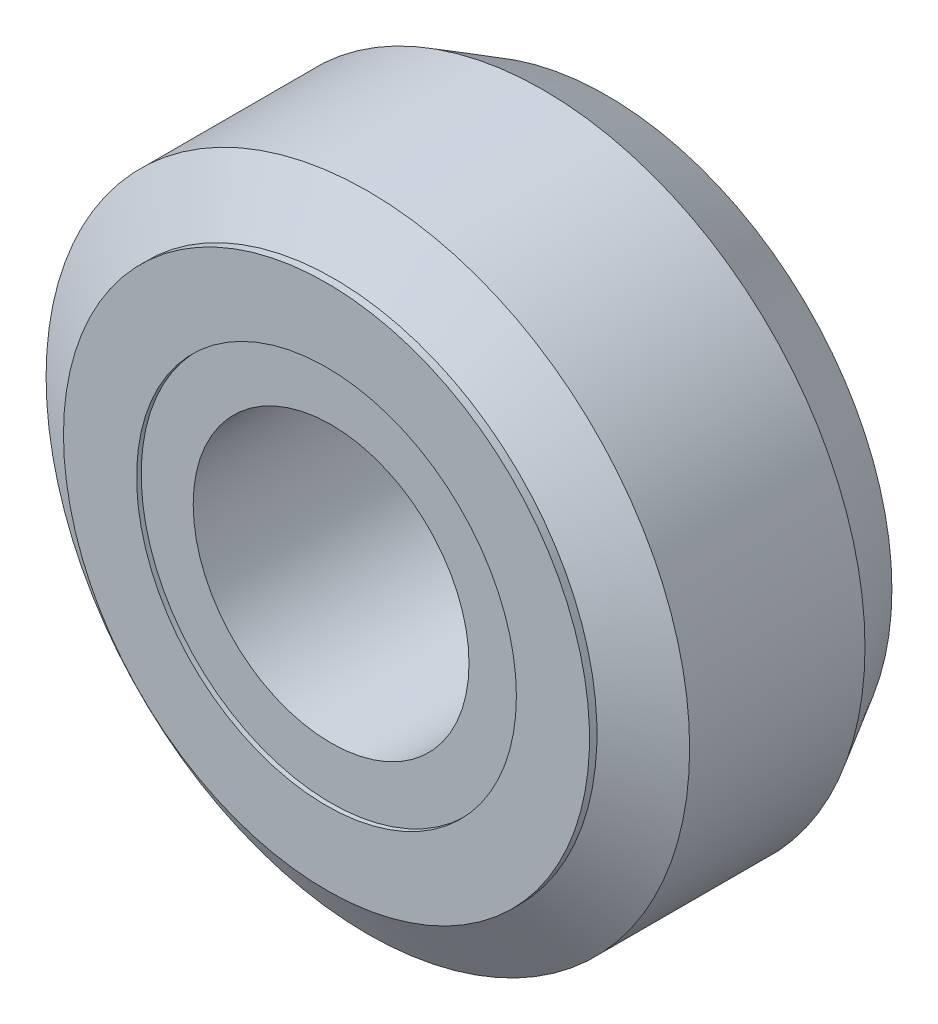
from build123d import *
from OCP.BRepFilletAPI import BRepFilletAPI_MakeChamfer

# Parameters (mm, degrees)
CROQUIS1_R              = 3.5
CROQUIS1_R_2            = 1.5
SALIENTE_EXTRUIR1_DEPTH = 1.5
CHAFL_N1_SIZE           = 0.4
CHAFL_N1_SIZE2          = 0.692820323
CROQUIS2_R              = 2.860932506
CROQUIS2_R_2            = 2.065541469
SALIENTE_EXTRUIR2_DEPTH = 1.55


with BuildPart() as part:
    # Croquis1 → Saliente-Extruir1 (new, symmetric)
    with BuildSketch(Plane.XY):
        Circle(CROQUIS1_R)
        Circle(CROQUIS1_R_2, mode=Mode.SUBTRACT)
    extrude(amount=SALIENTE_EXTRUIR1_DEPTH, both=True)

    # Chaflán1: one chamfer whose edges measure the first distance from different faces: ONE call of the kernel's chamfer builder (chamfer() names one face for all edges)
    chafl_n1_edges_1 = [part.edges().sort_by_distance(p)[0] for p in [
        (-3.5, 0, -1.5),
    ]]
    chafl_n1_side_1 = [part.faces().sort_by_distance(p)[0] for p in [
        (-3.401005051, 0, -1.5),
    ]]
    chafl_n1_edges_2 = [part.edges().sort_by_distance(p)[0] for p in [
        (-3.5, 0, 1.5),
    ]]
    chafl_n1_side_2 = [part.faces().sort_by_distance(p)[0] for p in [
        (-3.5, 0, 0),
    ]]
    chafl_n1 = BRepFilletAPI_MakeChamfer(part.part.solid().wrapped)
    for e in chafl_n1_edges_1:
        chafl_n1.Add(CHAFL_N1_SIZE, CHAFL_N1_SIZE2, e.wrapped, chafl_n1_side_1[0].wrapped)  # the first distance lies on this face
    for e in chafl_n1_edges_2:
        chafl_n1.Add(CHAFL_N1_SIZE, CHAFL_N1_SIZE2, e.wrapped, chafl_n1_side_2[0].wrapped)  # the first distance lies on this face
    add(Compound.cast(chafl_n1.Shape()), mode=Mode.REPLACE)

    # Croquis2 → Saliente-Extruir2 (add, symmetric)
    with BuildSketch(Plane(origin=(0, 0, 0), x_dir=(-1, 0, 0), z_dir=(0, 0, -1))):
        Circle(CROQUIS2_R)
        with Locations(Location((0, 0, 0), (0, 0, 180))):
            Circle(CROQUIS2_R_2, mode=Mode.SUBTRACT)
    extrude(amount=SALIENTE_EXTRUIR2_DEPTH, both=True)


solid = part.part
